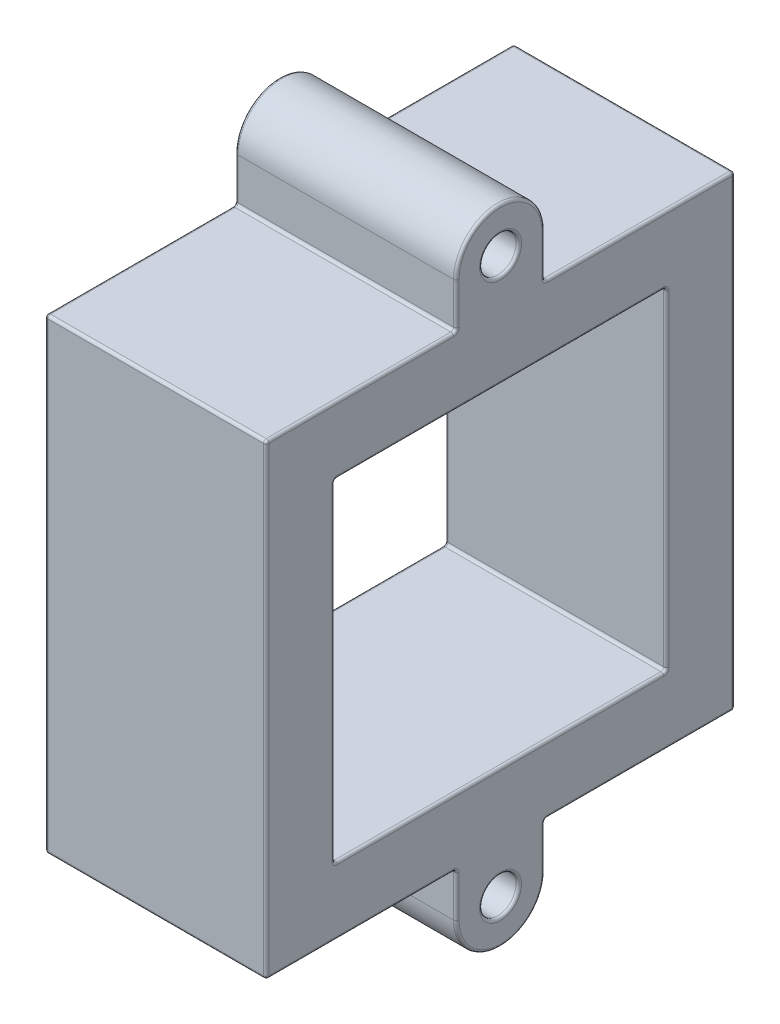
from build123d import *

# Parameters (mm, degrees)
SKETCH1_R           = 1.65
SKETCH1_W           = 30
SKETCH1_H           = 30
BOSS_EXTRUDE1_DEPTH = 20
FILLET18_R          = 0.25


with BuildPart() as part:
    # Sketch1 → Boss-Extrude1 (new body)
    with BuildSketch(Plane.YZ):
        with BuildLine():
            Line((-25.1, 4), (-21.1, 4))
            Line((-21.1, 4), (-21.1, 21.2))
            Line((-21.1, 21.2), (21.1, 21.2))
            Line((21.1, 21.2), (21.1, 4))
            Line((21.1, 4), (25.1, 4))
            ThreePointArc((25.1, 4), (29.1, 0), (25.1, -4))
            Line((25.1, -4), (21.1, -4))
            Line((21.1, -4), (21.1, -21.2))
            Line((21.1, -21.2), (-21.1, -21.2))
            Line((-21.1, -21.2), (-21.1, -4))
            Line((-21.1, -4), (-25.1, -4))
            ThreePointArc((-25.1, -4), (-29.1, 0), (-25.1, 4))
        make_face()
        with Locations(Location((-25.1, 0, 0), (0, 0, 270))):
            Circle(SKETCH1_R, mode=Mode.SUBTRACT)
        with Locations(Location((25.1, 0, 0), (0, 0, 90))):
            Circle(SKETCH1_R, mode=Mode.SUBTRACT)
        Rectangle(SKETCH1_W, SKETCH1_H, mode=Mode.SUBTRACT)
    extrude(amount=BOSS_EXTRUDE1_DEPTH)

    # Fillet18
    fillet18_edges = [part.edges().sort_by_distance(p)[0] for p in [
        (0, 0, -21.2),
        (0, -21.1, -12.6),
        (20, 29.1, 0),
        (0, -23.1, -4),
        (0, -29.1, 0),
        (0, -23.1, 4),
        (0, -21.1, 12.6),
        (0, 0, 21.2),
        (0, 21.1, 12.6),
        (0, 23.1, 4),
        (0, 29.1, 0),
        (0, 23.1, -4),
        (0, 21.1, -12.6),
        (20, 23.1, 4),
        (10, 21.1, -21.2),
        (10, -21.1, -21.2),
        (10, -21.1, -4),
        (20, 21.1, 12.6),
        (10, -21.1, 4),
        (10, -21.1, 21.2),
        (10, 21.1, 21.2),
        (10, 21.1, 4),
        (10, 21.1, -4),
        (20, 0, 21.2),
        (20, -21.1, 12.6),
        (20, -23.1, 4),
        (0, 15, 0),
        (10, 15, -15),
        (0, 0, 15),
        (10, 15, 15),
        (0, -15, 0),
        (10, -15, 15),
        (0, 0, -15),
        (10, -15, -15),
        (20, 15, 0),
        (20, 0, 15),
        (20, -15, 0),
        (20, 0, -15),
        (20, -29.1, 0),
        (20, -23.1, -4),
        (0, -25.1, 1.65),
        (20, -25.1, 1.65),
        (20, -21.1, -12.6),
        (0, 25.1, -1.65),
        (20, 25.1, -1.65),
        (20, 0, -21.2),
        (20, 21.1, -12.6),
        (20, 23.1, -4),
    ]]
    fillet(fillet18_edges, radius=FILLET18_R)


solid = part.part
